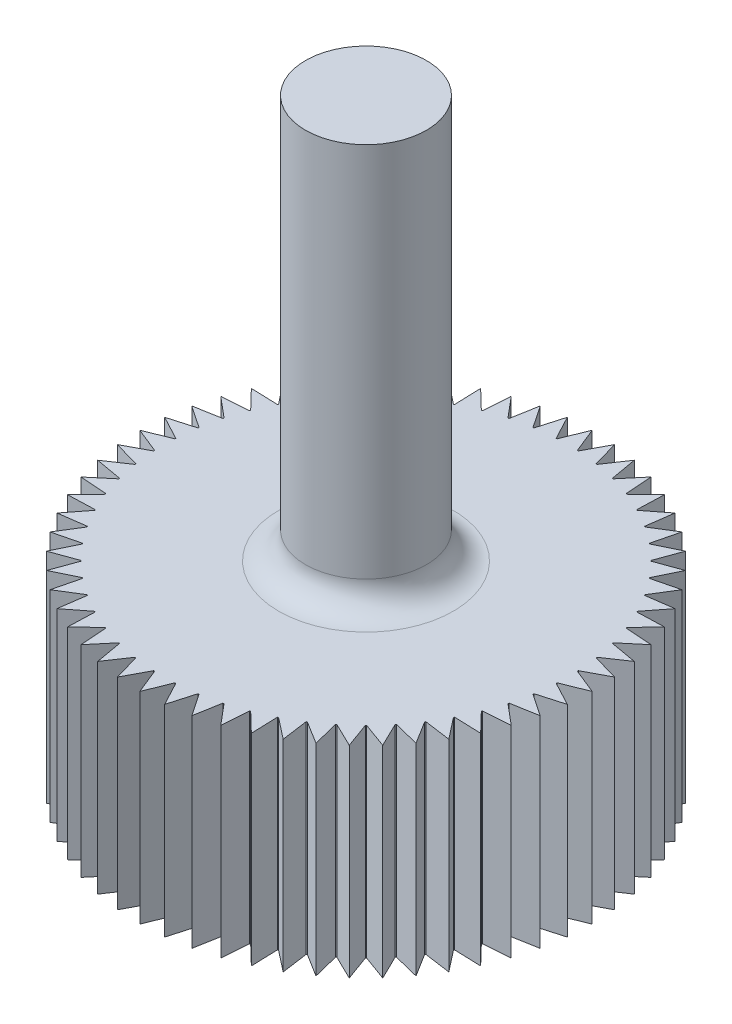
from build123d import *

# Parameters (mm, degrees)
SKETCH2_R                = 4
BOSS_EXTRUDE1_DEPTH      = 15
BOSS_EXTRUDE2_DEPTH      = 30
BOSS_EXTRUDE2_DEPTH_BACK = 1
BOSS_EXTRUDE2_START      = 15
SKETCH2_3_R              = 4.5
FILLET1_R                = 2


with BuildPart() as part:
    # Sketch2 → Boss-Extrude1 (new body)
    with BuildSketch(Plane(origin=(0, 0, 0), x_dir=(1, 0, 0), z_dir=(0, 1, 0))):
        with BuildLine():
            Line((0, 16.835287888), (-0.75, 14.981238267))
            ThreePointArc((-0.75, 14.981238267), (-0.785039344, 14.979443021), (-0.820074392, 14.977565823))
            Line((-0.820074392, 14.977565823), (-1.759766772, 16.74306242))
            Line((-1.759766772, 16.74306242), (-2.311857235, 14.820773128))
            ThreePointArc((-2.311857235, 14.820773128), (-2.346516976, 14.815325109), (-2.381163878, 14.809796035))
            Line((-2.381163878, 14.809796035), (-3.50025317, 16.467396456))
            Line((-3.50025317, 16.467396456), (-3.848385279, 14.497928498))
            ThreePointArc((-3.848385279, 14.497928498), (-3.882285677, 14.488887394), (-3.916164834, 14.479767021))
            Line((-3.916164834, 14.479767021), (-5.202390063, 16.01131025))
            Line((-5.202390063, 16.01131025), (-5.342749608, 14.01624153))
            ThreePointArc((-5.342749608, 14.01624153), (-5.375519243, 14.003706397), (-5.408259468, 13.991094651))
            Line((-5.408259468, 13.991094651), (-6.847528481, 15.379800779))
            Line((-6.847528481, 15.379800779), (-6.778577655, 13.380989686))
            ThreePointArc((-6.778577655, 13.380989686), (-6.809857496, 13.365097863), (-6.84110008, 13.349132919))
            Line((-6.84110008, 13.349132919), (-8.417643944, 14.579786991))
            Line((-8.417643944, 14.579786991), (-8.140138186, 12.599132919))
            ThreePointArc((-8.140138186, 12.599132919), (-8.169585525, 12.580058519), (-8.198988168, 12.560915294))
            Line((-8.198988168, 12.560915294), (-9.895533939, 13.620034007))
            Line((-9.895533939, 13.620034007), (-9.41251366, 11.679237415))
            ThreePointArc((-9.41251366, 11.679237415), (-9.439805866, 11.657189422), (-9.467046426, 11.635077652))
            Line((-9.467046426, 11.635077652), (-11.265006393, 12.51105708))
            Line((-11.265006393, 12.51105708), (-10.581763664, 10.631381742))
            ThreePointArc((-10.581763664, 10.631381742), (-10.606601718, 10.606601718), (-10.631381742, 10.581763664))
            Line((-10.631381742, 10.581763664), (-12.51105708, 11.265006393))
            Line((-12.51105708, 11.265006393), (-11.635077652, 9.467046426))
            ThreePointArc((-11.635077652, 9.467046426), (-11.657189422, 9.439805866), (-11.679237415, 9.41251366))
            Line((-11.679237415, 9.41251366), (-13.620034007, 9.895533939))
            Line((-13.620034007, 9.895533939), (-12.560915294, 8.198988168))
            ThreePointArc((-12.560915294, 8.198988168), (-12.580058519, 8.169585525), (-12.599132919, 8.140138186))
            Line((-12.599132919, 8.140138186), (-14.579786991, 8.417643944))
            Line((-14.579786991, 8.417643944), (-13.349132919, 6.84110008))
            ThreePointArc((-13.349132919, 6.84110008), (-13.365097863, 6.809857496), (-13.380989686, 6.778577655))
            Line((-13.380989686, 6.778577655), (-15.379800779, 6.847528481))
            Line((-15.379800779, 6.847528481), (-13.991094651, 5.408259468))
            ThreePointArc((-13.991094651, 5.408259468), (-14.003706397, 5.375519243), (-14.01624153, 5.342749608))
            Line((-14.01624153, 5.342749608), (-16.01131025, 5.202390063))
            Line((-16.01131025, 5.202390063), (-14.479767021, 3.916164834))
            ThreePointArc((-14.479767021, 3.916164834), (-14.488887394, 3.882285677), (-14.497928498, 3.848385279))
            Line((-14.497928498, 3.848385279), (-16.467396456, 3.50025317))
            Line((-16.467396456, 3.50025317), (-14.809796035, 2.381163878))
            ThreePointArc((-14.809796035, 2.381163878), (-14.815325109, 2.346516976), (-14.820773128, 2.311857235))
            Line((-14.820773128, 2.311857235), (-16.74306242, 1.759766772))
            Line((-16.74306242, 1.759766772), (-14.977565823, 0.820074392))
            ThreePointArc((-14.977565823, 0.820074392), (-14.979443021, 0.785039344), (-14.981238267, 0.75))
            Line((-14.981238267, 0.75), (-16.835287888, 0))
            Line((-16.835287888, 0), (-14.981238267, -0.75))
            ThreePointArc((-14.981238267, -0.75), (-14.979443021, -0.785039344), (-14.977565823, -0.820074392))
            Line((-14.977565823, -0.820074392), (-16.74306242, -1.759766772))
            Line((-16.74306242, -1.759766772), (-14.820773128, -2.311857235))
            ThreePointArc((-14.820773128, -2.311857235), (-14.815325109, -2.346516976), (-14.809796035, -2.381163878))
            Line((-14.809796035, -2.381163878), (-16.467396456, -3.50025317))
            Line((-16.467396456, -3.50025317), (-14.497928498, -3.848385279))
            ThreePointArc((-14.497928498, -3.848385279), (-14.488887394, -3.882285677), (-14.479767021, -3.916164834))
            Line((-14.479767021, -3.916164834), (-16.01131025, -5.202390063))
            Line((-16.01131025, -5.202390063), (-14.01624153, -5.342749608))
            ThreePointArc((-14.01624153, -5.342749608), (-14.003706397, -5.375519243), (-13.991094651, -5.408259468))
            Line((-13.991094651, -5.408259468), (-15.379800778, -6.847528481))
            Line((-15.379800778, -6.847528481), (-13.380989686, -6.778577655))
            ThreePointArc((-13.380989686, -6.778577655), (-13.365097863, -6.809857496), (-13.349132919, -6.84110008))
            Line((-13.349132919, -6.84110008), (-14.579786991, -8.417643944))
            Line((-14.579786991, -8.417643944), (-12.599132919, -8.140138186))
            ThreePointArc((-12.599132919, -8.140138186), (-12.580058519, -8.169585525), (-12.560915294, -8.198988168))
            Line((-12.560915294, -8.198988168), (-13.620034007, -9.895533939))
            Line((-13.620034007, -9.895533939), (-11.679237415, -9.41251366))
            ThreePointArc((-11.679237415, -9.41251366), (-11.657189422, -9.439805866), (-11.635077652, -9.467046426))
            Line((-11.635077652, -9.467046426), (-12.51105708, -11.265006393))
            Line((-12.51105708, -11.265006393), (-10.631381742, -10.581763664))
            ThreePointArc((-10.631381742, -10.581763664), (-10.606601718, -10.606601718), (-10.581763664, -10.631381742))
            Line((-10.581763664, -10.631381742), (-11.265006393, -12.51105708))
            Line((-11.265006393, -12.51105708), (-9.467046426, -11.635077652))
            ThreePointArc((-9.467046426, -11.635077652), (-9.439805866, -11.657189422), (-9.41251366, -11.679237415))
            Line((-9.41251366, -11.679237415), (-9.895533939, -13.620034007))
            Line((-9.895533939, -13.620034007), (-8.198988168, -12.560915294))
            ThreePointArc((-8.198988168, -12.560915294), (-8.169585525, -12.580058519), (-8.140138186, -12.599132919))
            Line((-8.140138186, -12.599132919), (-8.417643944, -14.579786991))
            Line((-8.417643944, -14.579786991), (-6.84110008, -13.349132919))
            ThreePointArc((-6.84110008, -13.349132919), (-6.809857496, -13.365097863), (-6.778577655, -13.380989686))
            Line((-6.778577655, -13.380989686), (-6.847528481, -15.379800779))
            Line((-6.847528481, -15.379800779), (-5.408259468, -13.991094651))
            ThreePointArc((-5.408259468, -13.991094651), (-5.375519243, -14.003706397), (-5.342749608, -14.01624153))
            Line((-5.342749608, -14.01624153), (-5.202390063, -16.01131025))
            Line((-5.202390063, -16.01131025), (-3.916164834, -14.479767021))
            ThreePointArc((-3.916164834, -14.479767021), (-3.882285677, -14.488887394), (-3.848385279, -14.497928498))
            Line((-3.848385279, -14.497928498), (-3.50025317, -16.467396456))
            Line((-3.50025317, -16.467396456), (-2.381163878, -14.809796035))
            ThreePointArc((-2.381163878, -14.809796035), (-2.346516976, -14.815325109), (-2.311857235, -14.820773128))
            Line((-2.311857235, -14.820773128), (-1.759766772, -16.74306242))
            Line((-1.759766772, -16.74306242), (-0.820074392, -14.977565823))
            ThreePointArc((-0.820074392, -14.977565823), (-0.785039344, -14.979443021), (-0.75, -14.981238267))
            Line((-0.75, -14.981238267), (0, -16.835287888))
            Line((0, -16.835287888), (0.75, -14.981238267))
            ThreePointArc((0.75, -14.981238267), (0.785039344, -14.979443021), (0.820074392, -14.977565823))
            Line((0.820074392, -14.977565823), (1.759766772, -16.74306242))
            Line((1.759766772, -16.74306242), (2.311857235, -14.820773128))
            ThreePointArc((2.311857235, -14.820773128), (2.346516976, -14.815325109), (2.381163878, -14.809796035))
            Line((2.381163878, -14.809796035), (3.50025317, -16.467396456))
            Line((3.50025317, -16.467396456), (3.848385279, -14.497928498))
            ThreePointArc((3.848385279, -14.497928498), (3.882285677, -14.488887394), (3.916164834, -14.479767021))
            Line((3.916164834, -14.479767021), (5.202390063, -16.01131025))
            Line((5.202390063, -16.01131025), (5.342749608, -14.01624153))
            ThreePointArc((5.342749608, -14.01624153), (5.375519243, -14.003706397), (5.408259468, -13.991094651))
            Line((5.408259468, -13.991094651), (6.847528481, -15.379800779))
            Line((6.847528481, -15.379800779), (6.778577655, -13.380989686))
            ThreePointArc((6.778577655, -13.380989686), (6.809857496, -13.365097863), (6.84110008, -13.349132919))
            Line((6.84110008, -13.349132919), (8.417643944, -14.579786991))
            Line((8.417643944, -14.579786991), (8.140138186, -12.599132919))
            ThreePointArc((8.140138186, -12.599132919), (8.169585525, -12.580058519), (8.198988168, -12.560915294))
            Line((8.198988168, -12.560915294), (9.895533939, -13.620034007))
            Line((9.895533939, -13.620034007), (9.41251366, -11.679237415))
            ThreePointArc((9.41251366, -11.679237415), (9.439805866, -11.657189422), (9.467046426, -11.635077652))
            Line((9.467046426, -11.635077652), (11.265006393, -12.51105708))
            Line((11.265006393, -12.51105708), (10.581763664, -10.631381742))
            ThreePointArc((10.581763664, -10.631381742), (10.606601718, -10.606601718), (10.631381742, -10.581763664))
            Line((10.631381742, -10.581763664), (12.51105708, -11.265006393))
            Line((12.51105708, -11.265006393), (11.635077652, -9.467046426))
            ThreePointArc((11.635077652, -9.467046426), (11.657189422, -9.439805866), (11.679237415, -9.41251366))
            Line((11.679237415, -9.41251366), (13.620034007, -9.895533939))
            Line((13.620034007, -9.895533939), (12.560915294, -8.198988168))
            ThreePointArc((12.560915294, -8.198988168), (12.580058519, -8.169585525), (12.599132919, -8.140138186))
            Line((12.599132919, -8.140138186), (14.579786991, -8.417643944))
            Line((14.579786991, -8.417643944), (13.349132919, -6.84110008))
            ThreePointArc((13.349132919, -6.84110008), (13.365097863, -6.809857496), (13.380989686, -6.778577655))
            Line((13.380989686, -6.778577655), (15.379800779, -6.847528481))
            Line((15.379800779, -6.847528481), (13.991094651, -5.408259468))
            ThreePointArc((13.991094651, -5.408259468), (14.003706397, -5.375519243), (14.01624153, -5.342749608))
            Line((14.01624153, -5.342749608), (16.01131025, -5.202390063))
            Line((16.01131025, -5.202390063), (14.479767021, -3.916164834))
            ThreePointArc((14.479767021, -3.916164834), (14.488887394, -3.882285677), (14.497928498, -3.848385279))
            Line((14.497928498, -3.848385279), (16.467396456, -3.50025317))
            Line((16.467396456, -3.50025317), (14.809796035, -2.381163878))
            ThreePointArc((14.809796035, -2.381163878), (14.815325109, -2.346516976), (14.820773128, -2.311857235))
            Line((14.820773128, -2.311857235), (16.74306242, -1.759766772))
            Line((16.74306242, -1.759766772), (14.977565823, -0.820074392))
            ThreePointArc((14.977565823, -0.820074392), (14.979443021, -0.785039344), (14.981238267, -0.75))
            Line((14.981238267, -0.75), (16.835287888, 0))
            Line((16.835287888, 0), (14.981238267, 0.75))
            ThreePointArc((14.981238267, 0.75), (14.979443021, 0.785039344), (14.977565823, 0.820074392))
            Line((14.977565823, 0.820074392), (16.74306242, 1.759766772))
            Line((16.74306242, 1.759766772), (14.820773128, 2.311857235))
            ThreePointArc((14.820773128, 2.311857235), (14.815325109, 2.346516976), (14.809796035, 2.381163878))
            Line((14.809796035, 2.381163878), (16.467396456, 3.50025317))
            Line((16.467396456, 3.50025317), (14.497928498, 3.848385279))
            ThreePointArc((14.497928498, 3.848385279), (14.488887394, 3.882285677), (14.479767021, 3.916164834))
            Line((14.479767021, 3.916164834), (16.01131025, 5.202390063))
            Line((16.01131025, 5.202390063), (14.01624153, 5.342749608))
            ThreePointArc((14.01624153, 5.342749608), (14.003706397, 5.375519243), (13.991094651, 5.408259468))
            Line((13.991094651, 5.408259468), (15.379800779, 6.847528481))
            Line((15.379800779, 6.847528481), (13.380989686, 6.778577655))
            ThreePointArc((13.380989686, 6.778577655), (13.365097863, 6.809857496), (13.349132919, 6.84110008))
            Line((13.349132919, 6.84110008), (14.579786991, 8.417643944))
            Line((14.579786991, 8.417643944), (12.599132919, 8.140138186))
            ThreePointArc((12.599132919, 8.140138186), (12.580058519, 8.169585525), (12.560915294, 8.198988168))
            Line((12.560915294, 8.198988168), (13.620034007, 9.895533939))
            Line((13.620034007, 9.895533939), (11.679237415, 9.41251366))
            ThreePointArc((11.679237415, 9.41251366), (11.657189422, 9.439805866), (11.635077652, 9.467046426))
            Line((11.635077652, 9.467046426), (12.51105708, 11.265006393))
            Line((12.51105708, 11.265006393), (10.631381742, 10.581763664))
            ThreePointArc((10.631381742, 10.581763664), (10.606601718, 10.606601718), (10.581763664, 10.631381742))
            Line((10.581763664, 10.631381742), (11.265006393, 12.51105708))
            Line((11.265006393, 12.51105708), (9.467046426, 11.635077652))
            ThreePointArc((9.467046426, 11.635077652), (9.439805866, 11.657189422), (9.41251366, 11.679237415))
            Line((9.41251366, 11.679237415), (9.895533939, 13.620034007))
            Line((9.895533939, 13.620034007), (8.198988168, 12.560915294))
            ThreePointArc((8.198988168, 12.560915294), (8.169585525, 12.580058519), (8.140138186, 12.599132919))
            Line((8.140138186, 12.599132919), (8.417643944, 14.579786991))
            Line((8.417643944, 14.579786991), (6.84110008, 13.349132919))
            ThreePointArc((6.84110008, 13.349132919), (6.809857496, 13.365097863), (6.778577655, 13.380989686))
            Line((6.778577655, 13.380989686), (6.847528481, 15.379800779))
            Line((6.847528481, 15.379800779), (5.408259468, 13.991094651))
            ThreePointArc((5.408259468, 13.991094651), (5.375519243, 14.003706397), (5.342749608, 14.01624153))
            Line((5.342749608, 14.01624153), (5.202390063, 16.01131025))
            Line((5.202390063, 16.01131025), (3.916164834, 14.479767021))
            ThreePointArc((3.916164834, 14.479767021), (3.882285677, 14.488887394), (3.848385279, 14.497928498))
            Line((3.848385279, 14.497928498), (3.50025317, 16.467396456))
            Line((3.50025317, 16.467396456), (2.381163878, 14.809796035))
            ThreePointArc((2.381163878, 14.809796035), (2.346516976, 14.815325109), (2.311857235, 14.820773128))
            Line((2.311857235, 14.820773128), (1.759766772, 16.74306242))
            Line((1.759766772, 16.74306242), (0.820074392, 14.977565823))
            ThreePointArc((0.820074392, 14.977565823), (0.785039344, 14.979443021), (0.75, 14.981238267))
            Line((0.75, 14.981238267), (0, 16.835287888))
        make_face()
        with Locations(Location((0, 0, 0), (0, 0, 270))):
            Circle(SKETCH2_R, mode=Mode.SUBTRACT)
    extrude(amount=BOSS_EXTRUDE1_DEPTH)


with BuildPart() as body_2:
    # Sketch2<3> → Boss-Extrude2 (new, two sides: drawn at the far end of the back side and taken through both)
    with BuildSketch(Plane(origin=(0, 0, 0), x_dir=(1, 0, 0), z_dir=(0, 1, 0)).offset(BOSS_EXTRUDE2_START - BOSS_EXTRUDE2_DEPTH_BACK)):
        with Locations(Location((0, 0, 0), (0, 0, 270))):
            Circle(SKETCH2_3_R)
    extrude(amount=BOSS_EXTRUDE2_DEPTH + BOSS_EXTRUDE2_DEPTH_BACK)


with BuildPart() as part_1:
    add(part.part)

    # Combine1: union body 2
    add(body_2.part)

    # Fillet1
    fillet1_edges = [part_1.edges().sort_by_distance(p)[0] for p in [
        (0, 15, -4.5),
    ]]
    fillet(fillet1_edges, radius=FILLET1_R)


solid = part_1.part
